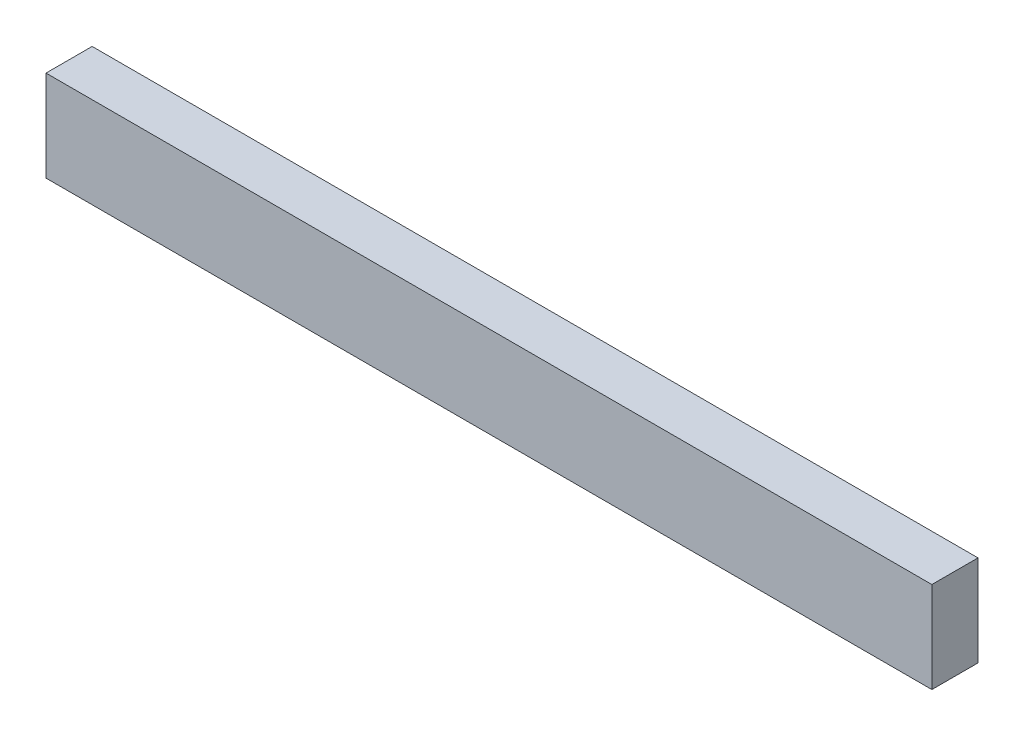
from build123d import *

# Parameters (mm, degrees)
SKICA1_W                = 48
SKICA1_H                = 4.93
P_IDAT_VYSUNUT_M1_DEPTH = 2.5


with BuildPart() as part:
    # Skica1 → Přidat vysunutím1 (new body)
    with BuildSketch(Plane.XY):
        Rectangle(SKICA1_W, SKICA1_H)
    extrude(amount=P_IDAT_VYSUNUT_M1_DEPTH)


solid = part.part
